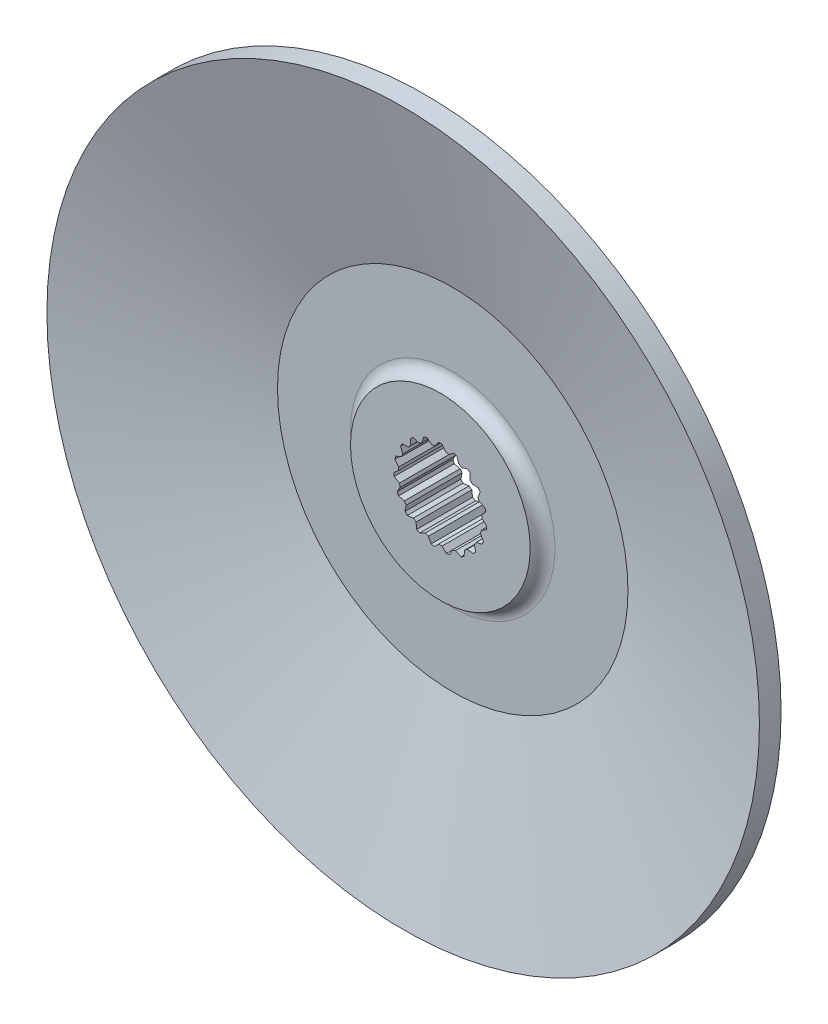
from build123d import *

# Parameters (mm, degrees)
CUT_EXTRUDE2_DEPTH = 82.813813015


with BuildPart() as part:
    # Sketch1 → Revolve1 (revolve)
    with BuildSketch(Plane(origin=(0, 0, 0), x_dir=(0, 0, -1), z_dir=(1, 0, 0)), mode=Mode.PRIVATE) as revolve1_sk:
        with BuildLine():
            Line((4.5, 6.75), (-4.5, 6.75))
            Line((-4.5, 6.75), (-4.5, 14.5))
            ThreePointArc((-4.5, 14.5), (-3.085786438, 15.085786438), (-2.5, 16.5))
            Line((-2.5, 16.5), (-2.5, 28.282608696))
            Line((-2.5, 28.282608696), (-10.5, 57.5))
            Line((-10.5, 57.5), (-7, 57.5))
            Line((-7, 57.5), (4.5, 15.5))
            Line((4.5, 15.5), (4.5, 6.75))
        make_face()
    revolve(revolve1_sk.sketch.rotate(Axis((0, 0, 0), (0, 0, 1)), 90), axis=Axis((0, 0, 0), (0, 0, 1)))

    # Sketch5 → Cut-Extrude2 (cut, through all)
    with BuildSketch(Plane.XY.offset(4.5)):
        with BuildLine():
            Line((-0.272121044, 7.495061717), (-0.84170062, 6.697315885))
            ThreePointArc((-0.84170062, 6.697315885), (0, 6.75), (0.84170062, 6.697315885))
            Line((0.84170062, 6.697315885), (0.272121044, 7.495061717))
            ThreePointArc((0.272121044, 7.495061717), (0, 7.5), (-0.272121044, 7.495061717))
        make_face()
        with BuildLine():
            Line((2.176265786, 7.177316158), (1.378519955, 6.607736582))
            ThreePointArc((1.378519955, 6.607736582), (2.191721417, 6.384266381), (2.970709872, 6.061137093))
            Line((2.970709872, 6.061137093), (2.691019336, 7.000601041))
            ThreePointArc((2.691019336, 7.000601041), (2.435246019, 7.093629313), (2.176265786, 7.177316158))
        make_face()
        with BuildLine():
            Line((4.38882045, 6.081797026), (3.449356502, 5.80210649))
            ThreePointArc((3.449356502, 5.80210649), (4.145935811, 5.326698438), (4.777796613, 4.768140048))
            Line((4.777796613, 4.768140048), (4.818303928, 5.747516617))
            ThreePointArc((4.818303928, 5.747516617), (4.606595345, 5.91855382), (4.38882045, 6.081797026))
        make_face()
        with BuildLine():
            Line((6.125778318, 4.327220817), (5.14640175, 4.367728131))
            ThreePointArc((5.14640175, 4.367728131), (5.650873728, 3.691900067), (6.067134957, 2.958441044))
            Line((6.067134957, 2.958441044), (6.423450525, 3.871599585))
            ThreePointArc((6.423450525, 3.871599585), (6.278748587, 4.102111186), (6.125778318, 4.327220817))
        make_face()
        with BuildLine():
            Line((7.198913054, 2.103723089), (6.285754514, 2.460038657))
            ThreePointArc((6.285754514, 2.460038657), (6.543451795, 1.657027038), (6.699005087, 0.828149048))
            Line((6.699005087, 0.828149048), (7.332516588, 1.576134664))
            ThreePointArc((7.332516588, 1.576134664), (7.270501995, 1.841141154), (7.198913054, 2.103723089))
        make_face()
        with BuildLine():
            Line((7.491933859, -0.347745678), (6.743948242, 0.285765823))
            ThreePointArc((6.743948242, 0.285765823), (6.726945328, -0.557410582), (6.60493407, -1.391885748))
            Line((6.60493407, -1.391885748), (7.446990703, -0.890128903))
            ThreePointArc((7.446990703, -0.890128903), (7.474383698, -0.619345091), (7.491933859, -0.347745678))
        make_face()
        with BuildLine():
            Line((6.97308738, -2.761530806), (6.471330536, -1.919474172))
            ThreePointArc((6.471330536, -1.919474172), (6.181469955, -2.711444116), (5.79511596, -3.461088125))
            Line((5.79511596, -3.461088125), (6.754467824, -3.259933193))
            ThreePointArc((6.754467824, -3.259933193), (6.86829995, -3.012715685), (6.97308738, -2.761530806))
        make_face()
        with BuildLine():
            Line((5.698598685, -4.87606122), (5.497443753, -3.916709357))
            ThreePointArc((5.497443753, -3.916709357), (4.966136397, -4.571650608), (4.357307116, -5.1552279))
            Line((4.357307116, -5.1552279), (5.329993549, -5.276473137))
            ThreePointArc((5.329993549, -5.276473137), (5.51792933, -5.079611787), (5.698598685, -4.87606122))
        make_face()
        with BuildLine():
            Line((3.8065784, -6.462194742), (3.927823637, -5.489508309))
            ThreePointArc((3.927823637, -5.489508309), (3.212644903, -5.936447821), (2.447316435, -6.29071874))
            Line((2.447316435, -6.29071874), (3.32793177, -6.721225345))
            ThreePointArc((3.32793177, -6.721225345), (3.569605448, -6.596053134), (3.8065784, -6.462194742))
        make_face()
        with BuildLine():
            Line((1.50205628, -7.348049192), (1.932562884, -6.467433857))
            ThreePointArc((1.932562884, -6.467433857), (1.111013484, -6.657938798), (0.272121044, -6.744512595))
            Line((0.272121044, -6.744512595), (0.965236945, -7.437628496))
            ThreePointArc((0.965236945, -7.437628496), (1.234459427, -7.397709776), (1.50205628, -7.348049192))
        make_face()
        with BuildLine():
            Line((-0.965236945, -7.437628496), (-0.272121044, -6.744512595))
            ThreePointArc((-0.272121044, -6.744512595), (-1.111013484, -6.657938798), (-1.932562884, -6.467433857))
            Line((-1.932562884, -6.467433857), (-1.50205628, -7.348049192))
            ThreePointArc((-1.50205628, -7.348049192), (-1.234459427, -7.397709776), (-0.965236945, -7.437628496))
        make_face()
        with BuildLine():
            Line((-3.32793177, -6.721225345), (-2.447316435, -6.29071874))
            ThreePointArc((-2.447316435, -6.29071874), (-3.212644903, -5.936447821), (-3.927823637, -5.489508309))
            Line((-3.927823637, -5.489508309), (-3.8065784, -6.462194742))
            ThreePointArc((-3.8065784, -6.462194742), (-3.569605448, -6.596053134), (-3.32793177, -6.721225345))
        make_face()
        with BuildLine():
            Line((-5.329993549, -5.276473137), (-4.357307116, -5.1552279))
            ThreePointArc((-4.357307116, -5.1552279), (-4.966136397, -4.571650608), (-5.497443753, -3.916709357))
            Line((-5.497443753, -3.916709357), (-5.698598685, -4.87606122))
            ThreePointArc((-5.698598685, -4.87606122), (-5.51792933, -5.079611787), (-5.329993549, -5.276473137))
        make_face()
        with BuildLine():
            Line((-6.754467824, -3.259933193), (-5.79511596, -3.461088125))
            ThreePointArc((-5.79511596, -3.461088125), (-6.181469955, -2.711444116), (-6.471330536, -1.919474172))
            Line((-6.471330536, -1.919474172), (-6.97308738, -2.761530806))
            ThreePointArc((-6.97308738, -2.761530806), (-6.86829995, -3.012715685), (-6.754467824, -3.259933193))
        make_face()
        with BuildLine():
            Line((-7.446990703, -0.890128903), (-6.60493407, -1.391885748))
            ThreePointArc((-6.60493407, -1.391885748), (-6.726945328, -0.557410582), (-6.743948242, 0.285765823))
            Line((-6.743948242, 0.285765823), (-7.491933859, -0.347745678))
            ThreePointArc((-7.491933859, -0.347745678), (-7.474383698, -0.619345091), (-7.446990703, -0.890128903))
        make_face()
        with BuildLine():
            Line((-7.332516588, 1.576134664), (-6.699005087, 0.828149048))
            ThreePointArc((-6.699005087, 0.828149048), (-6.543451795, 1.657027038), (-6.285754514, 2.460038657))
            Line((-6.285754514, 2.460038657), (-7.198913054, 2.103723089))
            ThreePointArc((-7.198913054, 2.103723089), (-7.270501995, 1.841141154), (-7.332516588, 1.576134664))
        make_face()
        with BuildLine():
            Line((-6.423450525, 3.871599585), (-6.067134957, 2.958441044))
            ThreePointArc((-6.067134957, 2.958441044), (-5.650873728, 3.691900067), (-5.14640175, 4.367728131))
            Line((-5.14640175, 4.367728131), (-6.125778318, 4.327220817))
            ThreePointArc((-6.125778318, 4.327220817), (-6.278748587, 4.102111186), (-6.423450525, 3.871599585))
        make_face()
        with BuildLine():
            Line((-4.818303928, 5.747516617), (-4.777796613, 4.768140048))
            ThreePointArc((-4.777796613, 4.768140048), (-4.145935811, 5.326698438), (-3.449356502, 5.80210649))
            Line((-3.449356502, 5.80210649), (-4.38882045, 6.081797026))
            ThreePointArc((-4.38882045, 6.081797026), (-4.606595345, 5.91855382), (-4.818303928, 5.747516617))
        make_face()
        with BuildLine():
            Line((-2.691019336, 7.000601041), (-2.970709872, 6.061137093))
            ThreePointArc((-2.970709872, 6.061137093), (-2.191721417, 6.384266381), (-1.378519955, 6.607736582))
            Line((-1.378519955, 6.607736582), (-2.176265786, 7.177316158))
            ThreePointArc((-2.176265786, 7.177316158), (-2.435246019, 7.093629313), (-2.691019336, 7.000601041))
        make_face()
    extrude(amount=-CUT_EXTRUDE2_DEPTH, mode=Mode.SUBTRACT)


solid = part.part
